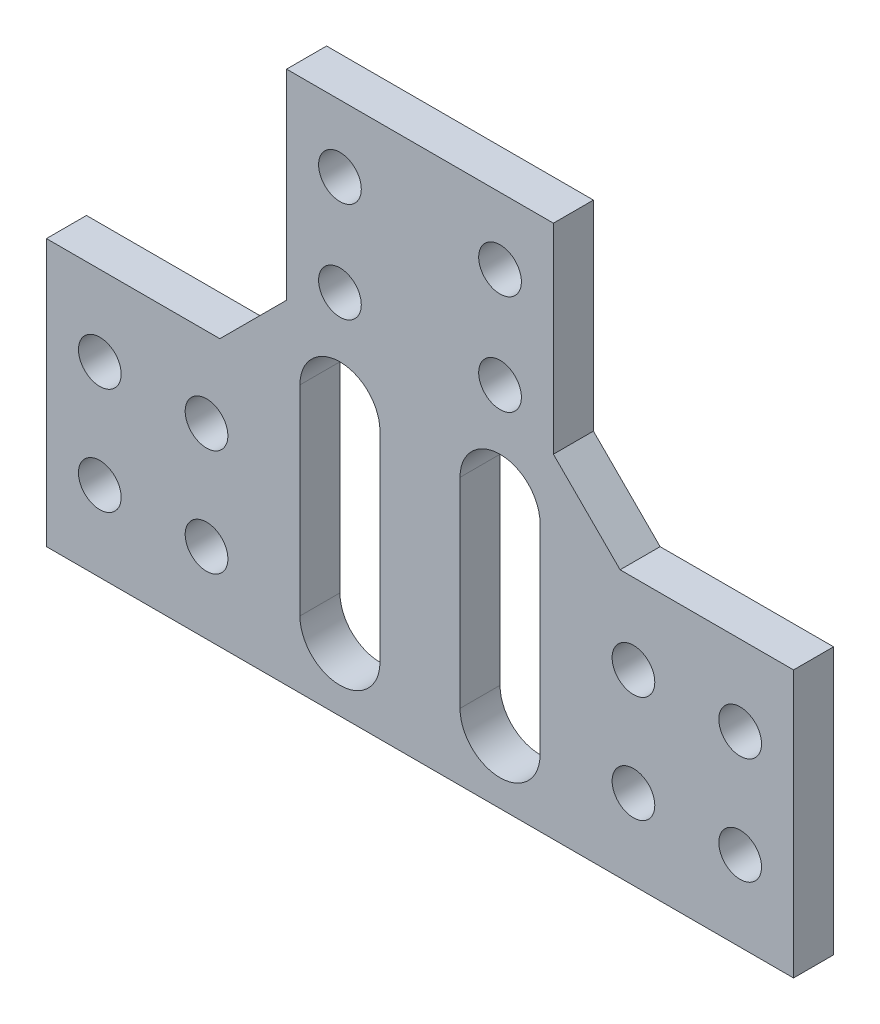
from build123d import *

# Parameters (mm, degrees)
EXTRUDE_1_DEPTH     = 3
SKETCH_2_R          = 1.6
CUT_EXTRUDE_1_DEPTH = 3
CUT_EXTRUDE_2_DEPTH = 10


with BuildPart() as part:
    # 草图1 → 凸台-拉伸1 (new body)
    with BuildSketch(Plane.XY):
        Polygon((0, 0), (56, 0), (56, 20), (43, 20), (38, 25), (38, 40), (18, 40), (18, 25), (13, 20), (0, 20), align=None)
    extrude(amount=EXTRUDE_1_DEPTH)

    # 草图2 → 切除-拉伸1 (cut)
    with BuildSketch(Plane.XY.offset(3)):
        with Locations((22, 35)):
            Circle(SKETCH_2_R)
        with Locations((34, 35)):
            Circle(SKETCH_2_R)
        with Locations((22, 27.5)):
            Circle(SKETCH_2_R)
        with Locations((34, 27.5)):
            Circle(SKETCH_2_R)
        with Locations((4, 14)):
            Circle(SKETCH_2_R)
        with Locations((4, 6)):
            Circle(SKETCH_2_R)
        with Locations((12, 14)):
            Circle(SKETCH_2_R)
        with Locations((12, 6)):
            Circle(SKETCH_2_R)
        with Locations((52, 14)):
            Circle(SKETCH_2_R)
        with Locations((52, 6)):
            Circle(SKETCH_2_R)
        with Locations((44, 6)):
            Circle(SKETCH_2_R)
        with Locations((44, 14)):
            Circle(SKETCH_2_R)
    extrude(amount=-CUT_EXTRUDE_1_DEPTH, mode=Mode.SUBTRACT)

    # 草图3 → 切除-拉伸2 (cut)
    with BuildSketch(Plane.XY.offset(3)):
        with BuildLine():
            Line((25, 20), (25, 5))
            ThreePointArc((25, 5), (22, 2), (19, 5))
            Line((19, 5), (19, 20))
            ThreePointArc((19, 20), (22, 23), (25, 20))
        make_face()
        with BuildLine():
            Line((37, 20), (37, 5))
            ThreePointArc((37, 5), (34, 2), (31, 5))
            Line((31, 5), (31, 20))
            ThreePointArc((31, 20), (34, 23), (37, 20))
        make_face()
    extrude(amount=-CUT_EXTRUDE_2_DEPTH, mode=Mode.SUBTRACT)


solid = part.part
